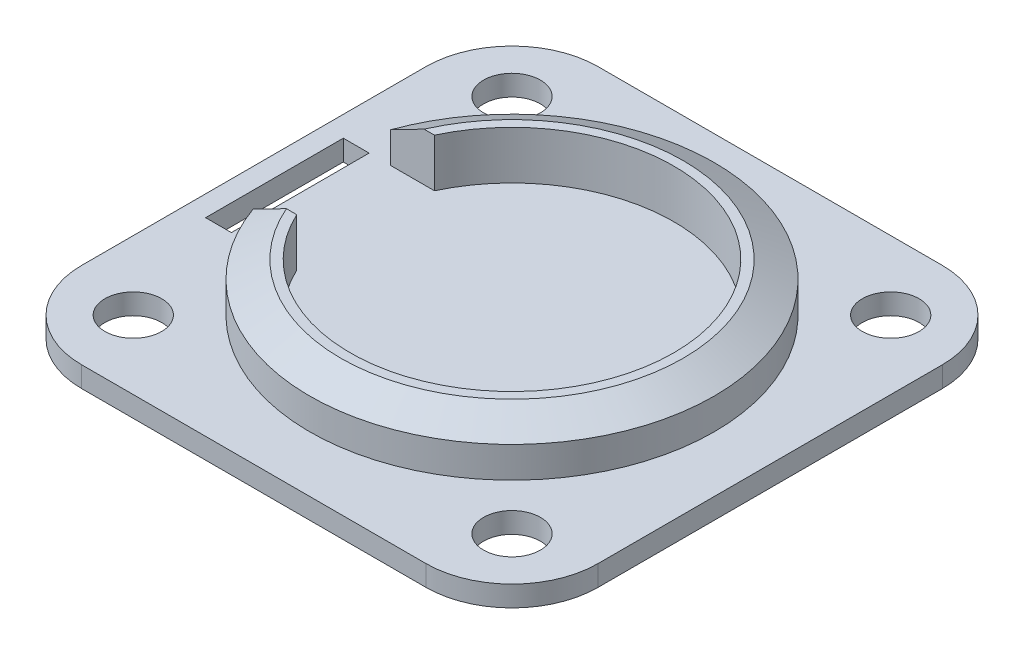
from build123d import *

# Parameters (mm, degrees)
SKETCH2_R           = 11.75
BOSS_EXTRUDE1_DEPTH = 4
CUT_EXTRUDE1_DEPTH  = 4
SKETCH4_W           = 30
SKETCH4_H           = 30
SKETCH4_R           = 1.65
BOSS_EXTRUDE2_DEPTH = 1.2
FILLET2_R           = 5
SKETCH6_W           = 1.5
SKETCH6_H           = 8
CUT_EXTRUDE2_DEPTH  = 10
CHAMFER1_SIZE       = 1
CHAMFER1_SIZE2      = 1.804047755


with BuildPart() as part:
    # Sketch2 → Boss-Extrude1 (new body)
    with BuildSketch(Plane(origin=(0, 0, 0), x_dir=(1, 0, 0), z_dir=(0, 1, 0))):
        with Locations(Location((0, 0, 0), (0, 0, 270))):
            Circle(SKETCH2_R)
    extrude(amount=BOSS_EXTRUDE1_DEPTH)

    # Sketch3 → Cut-Extrude1 (cut)
    with BuildSketch(Plane(origin=(0, 4, 0), x_dir=(1, 0, 0), z_dir=(0, 1, 0))):
        with BuildLine():
            Line((-8.506468127, 4), (-15.473450434, 4))
            Line((-15.473450434, 4), (-15.473450434, -4))
            Line((-15.473450434, -4), (-8.506468127, -4))
            ThreePointArc((-8.506468127, -4), (9.4, 0), (-8.506468127, 4))
        make_face()
    extrude(amount=-CUT_EXTRUDE1_DEPTH, mode=Mode.SUBTRACT)

    # Sketch4 → Boss-Extrude2 (add)
    with BuildSketch(Plane(origin=(0, 0, 0), x_dir=(1, 0, 0), z_dir=(0, 1, 0))):
        Rectangle(SKETCH4_W, SKETCH4_H)
        with Locations(Location((11, -11, 0), (0, 0, 270))):
            Circle(SKETCH4_R, mode=Mode.SUBTRACT)
        with Locations(Location((-11, -11, 0), (0, 0, 270))):
            Circle(SKETCH4_R, mode=Mode.SUBTRACT)
        with Locations(Location((-11, 11, 0), (0, 0, 270))):
            Circle(SKETCH4_R, mode=Mode.SUBTRACT)
        with Locations(Location((11, 11, 0), (0, 0, 270))):
            Circle(SKETCH4_R, mode=Mode.SUBTRACT)
    extrude(amount=BOSS_EXTRUDE2_DEPTH)

    # Fillet2
    fillet2_edges = [part.edges().sort_by_distance(p)[0] for p in [
        (15, 0.6, 15),
        (15, 0.6, -15),
        (-15, 0.6, -15),
        (-15, 0.6, 15),
    ]]
    fillet(fillet2_edges, radius=FILLET2_R)

    # Sketch6 → Cut-Extrude2 (cut)
    with BuildSketch(Plane(origin=(0, 0, 0), x_dir=(1, 0, 0), z_dir=(0, 1, 0))):
        with Locations((-13.05, 0)):
            Rectangle(SKETCH6_W, SKETCH6_H)
    extrude(amount=CUT_EXTRUDE2_DEPTH, mode=Mode.SUBTRACT)

    # Chamfer1
    chamfer1_edges = [part.edges().sort_by_distance(p)[0] for p in [
        (11.75, 4, 0),
    ]]
    chamfer1_side = [part.faces().sort_by_distance(p)[0] for p in [
        (11.75, 2.6, 0),
    ]]
    chamfer(chamfer1_edges, length=CHAMFER1_SIZE, length2=CHAMFER1_SIZE2, reference=chamfer1_side[0])


solid = part.part
